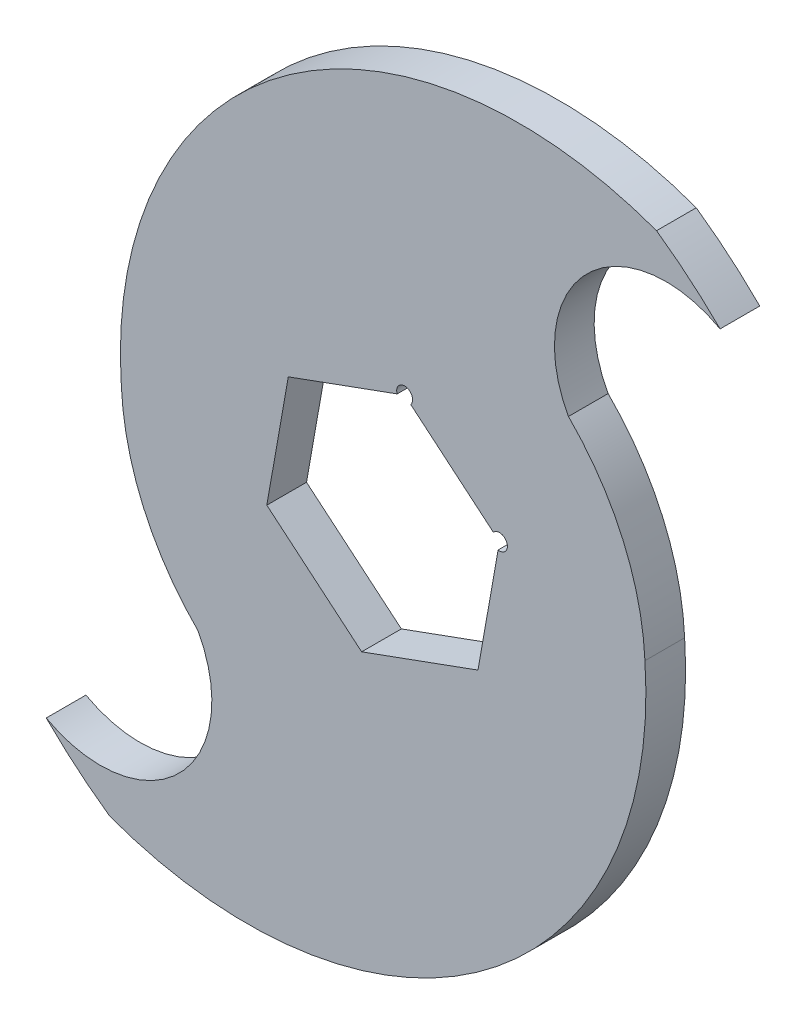
from build123d import *

# Parameters (mm, degrees)
BOSS_EXTRUDE1_DEPTH = 2.5


with BuildPart() as part:
    # Model → Boss-Extrude1 (new, symmetric)
    with BuildSketch(Plane.XY):
        with BuildLine():
            ThreePointArc((717.900029607, 115.214424851), (670.427821467, 108.213195948), (650.508452339, 64.557194238))
            ThreePointArc((650.508452339, 64.557194238), (653.283849766, 52.747710067), (660.139069353, 42.739078209))
            ThreePointArc((660.139069353, 42.739078209), (657.792156458, 25.994108012), (641.047186261, 23.647195117))
            ThreePointArc((641.047186261, 23.647195117), (644.900795358, 20.115585583), (649.047156658, 16.932779125))
            ThreePointArc((649.047156658, 16.932779125), (696.519364798, 23.934008028), (716.438733926, 67.590009739))
            ThreePointArc((716.438733926, 67.590009739), (713.663336498, 79.399493909), (706.808116912, 89.408125767))
            ThreePointArc((706.808116912, 89.408125767), (709.155029807, 106.153095964), (725.900000004, 108.500008859))
            ThreePointArc((725.900000004, 108.500008859), (722.046390907, 112.031618393), (717.900029607, 115.214424851))
        make_face()
        with BuildLine():
            Line((697.355906954, 72.047955987), (686.946544773, 80.782447954))
            ThreePointArc((686.946544773, 80.782447954), (686.354148507, 82.410043316), (685.240807709, 81.08321542))
            Line((685.240807709, 81.08321542), (671.532142065, 76.093669174))
            Line((671.532142065, 76.093669174), (668.825234868, 60.742035599))
            Line((668.825234868, 60.742035599), (680.766685935, 50.721968413))
            Line((680.766685935, 50.721968413), (695.415044199, 56.053534802))
            Line((695.415044199, 56.053534802), (697.948303219, 70.420360624))
            ThreePointArc((697.948303219, 70.420360624), (699.061644018, 71.747188521), (697.355906954, 72.047955987))
        make_face(mode=Mode.SUBTRACT)
    extrude(amount=BOSS_EXTRUDE1_DEPTH, both=True)


solid = part.part
